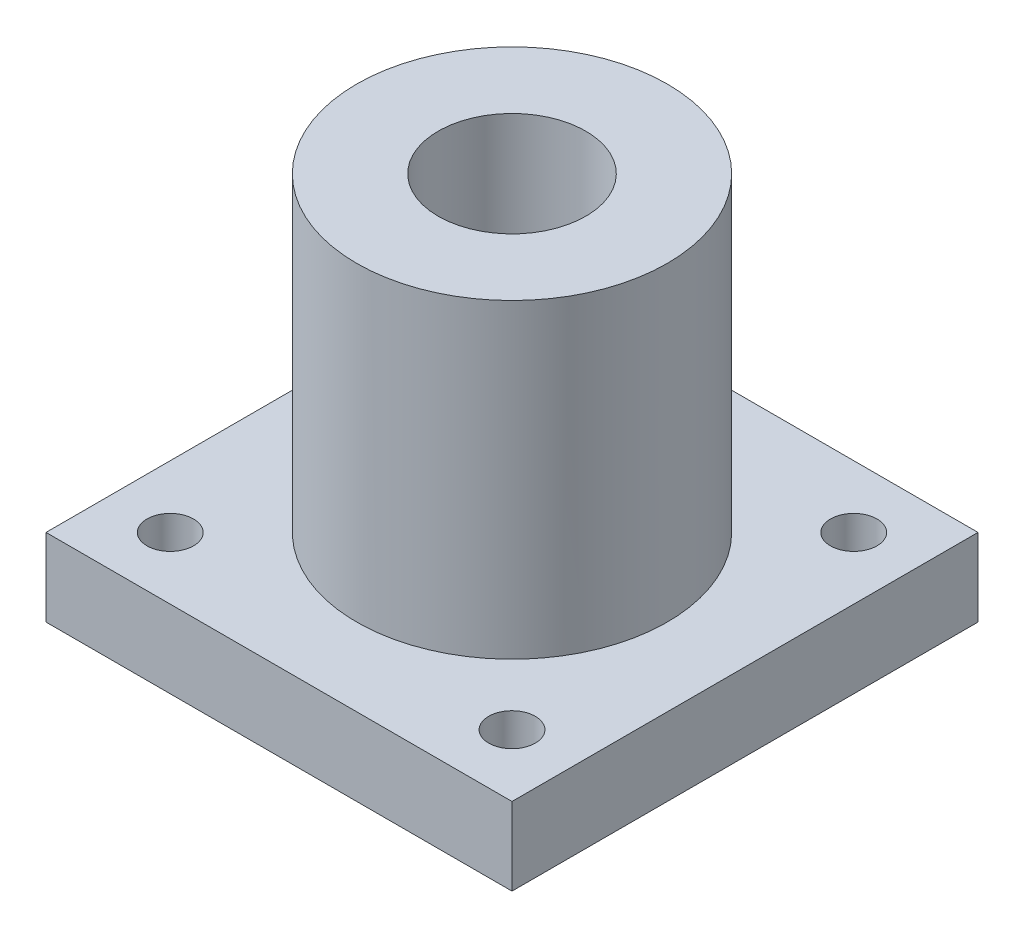
from build123d import *

# Parameters (mm, degrees)
IZIM1_W                     = 30
IZIM1_H                     = 30
IZIM1_R                     = 4.75
Y_KSEKLIK_EKSTR_ZYON1_DEPTH = 5
IZIM2_R                     = 10
IZIM2_R_2                   = 4.75
Y_KSEKLIK_EKSTR_ZYON2_DEPTH = 20
IZIM3_R                     = 1.5
KES_EKSTR_ZYON1_DEPTH       = 7


with BuildPart() as part:
    # Çizim1 → Yükseklik-Ekstrüzyon1 (new body)
    with BuildSketch(Plane(origin=(0, 0, 0), x_dir=(1, 0, 0), z_dir=(0, 1, 0))):
        with Locations((15, 15)):
            Rectangle(IZIM1_W, IZIM1_H)
        with Locations(Location((15, 15, 0), (0, 0, 270))):
            Circle(IZIM1_R, mode=Mode.SUBTRACT)
    extrude(amount=Y_KSEKLIK_EKSTR_ZYON1_DEPTH)

    # Çizim2 → Yükseklik-Ekstrüzyon2 (add)
    with BuildSketch(Plane(origin=(0, 5, 0), x_dir=(1, 0, 0), z_dir=(0, 1, 0))):
        with Locations(Location((15, 15, 0), (0, 0, 90))):
            Circle(IZIM2_R)
        with Locations(Location((15, 15, 0), (0, 0, 270))):
            Circle(IZIM2_R_2, mode=Mode.SUBTRACT)
    extrude(amount=Y_KSEKLIK_EKSTR_ZYON2_DEPTH)

    # Çizim3 → Kes-Ekstrüzyon1 (cut)
    with BuildSketch(Plane(origin=(0, 5, 0), x_dir=(1, 0, 0), z_dir=(0, 1, 0))):
        with Locations(Location((4, 26, 0), (0, 0, 270))):
            Circle(IZIM3_R)
        with Locations(Location((26, 26, 0), (0, 0, 270))):
            Circle(IZIM3_R)
        with Locations(Location((26, 4, 0), (0, 0, 270))):
            Circle(IZIM3_R)
        with Locations(Location((4, 4, 0), (0, 0, 270))):
            Circle(IZIM3_R)
    extrude(amount=-KES_EKSTR_ZYON1_DEPTH, mode=Mode.SUBTRACT)


solid = part.part
